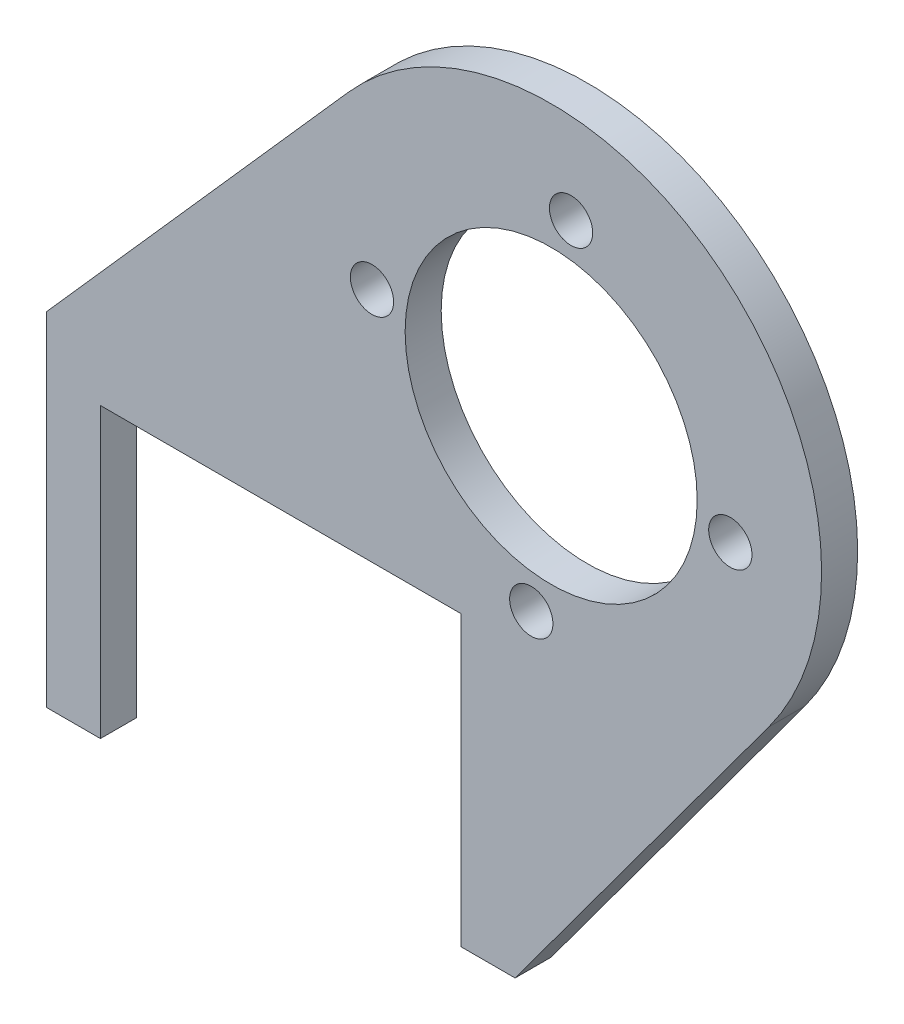
from build123d import *

# Parameters (mm, degrees)
ESQUISSE1_R        = 40.5
ESQUISSE1_R_2      = 6
BOSS_EXTRU_1_DEPTH = 10


with BuildPart() as part:
    # Esquisse1 → Boss.-Extru.1 (new body)
    with BuildSketch(Plane.XY):
        with BuildLine():
            Line((-25, -140), (-10, -140))
            Line((-10, -140), (60.378177886, -44.49129842))
            ThreePointArc((60.378177886, -44.49129842), (47.149121788, 58.326326085), (-56.15757152, 49.712444729))
            Line((-56.15757152, 49.712444729), (-140, -45))
            Line((-140, -45), (-140, -140))
            Line((-140, -140), (-125, -140))
            Line((-125, -140), (-125, -60))
            Line((-125, -60), (-25, -60))
            Line((-25, -60), (-25, -140))
        make_face()
        Circle(ESQUISSE1_R, mode=Mode.SUBTRACT)
        with Locations((-49.686682345, 5.520742483)):
            Circle(ESQUISSE1_R_2, mode=Mode.SUBTRACT)
        with Locations((5.520742483, 49.686682345)):
            Circle(ESQUISSE1_R_2, mode=Mode.SUBTRACT)
        with Locations((49.686682345, -5.520742483)):
            Circle(ESQUISSE1_R_2, mode=Mode.SUBTRACT)
        with Locations((-5.520742483, -49.686682345)):
            Circle(ESQUISSE1_R_2, mode=Mode.SUBTRACT)
    extrude(amount=BOSS_EXTRU_1_DEPTH)


solid = part.part
